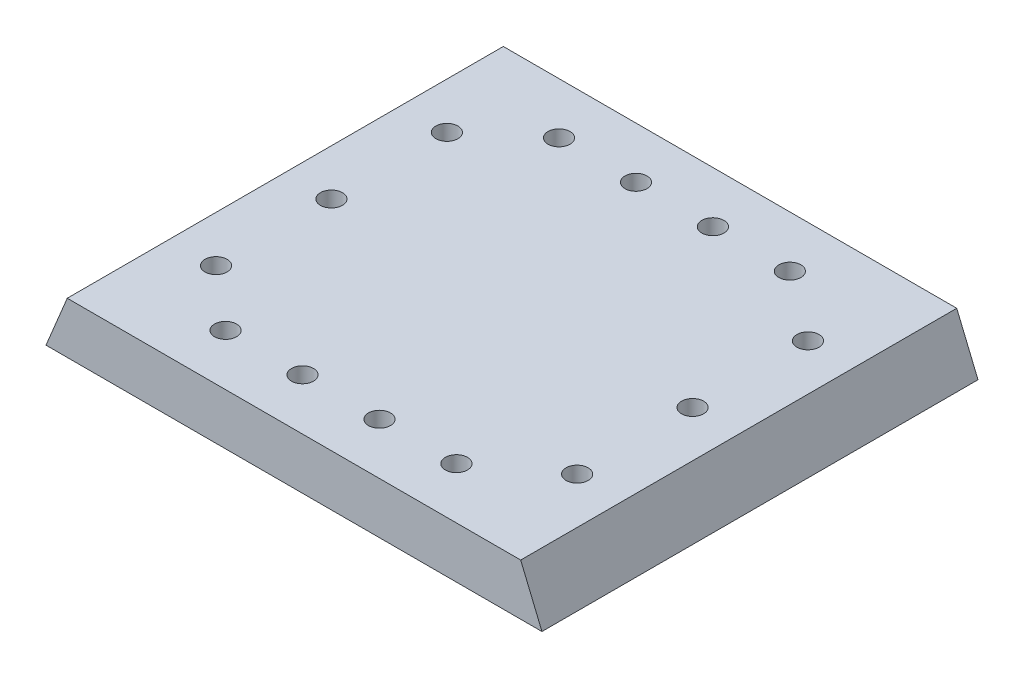
from build123d import *

# Parameters (mm, degrees)
BOSS_EXTRUDE1_DEPTH = 85
SKETCH3_R           = 2.15
CUT_EXTRUDE1_DEPTH  = 85
LPATTERN1_COUNT     = 4
LPATTERN1_PITCH     = 15
SKETCH4_R           = 2.15
CUT_EXTRUDE2_DEPTH  = 85


with BuildPart() as part:
    # Sketch2 → Boss-Extrude1 (new body)
    with BuildSketch(Plane.XY):
        Polygon((0, 0), (96.674271247, 0), (92.532135624, 10), (4.142135624, 10), align=None)
    extrude(amount=BOSS_EXTRUDE1_DEPTH)

    # Sketch3 → Cut-Extrude1 (cut)
    with BuildSketch(Plane.XZ):
        with Locations(Location((25, 75, 0), (0, 0, 270))):
            Circle(SKETCH3_R)
        with Locations((25, 10)):
            Circle(SKETCH3_R)
    cut_extrude1 = extrude(amount=-CUT_EXTRUDE1_DEPTH, mode=Mode.SUBTRACT)

    # LPattern1: Cut-Extrude1 ×4
    with Locations(*[(i * LPATTERN1_PITCH, 0, 0) for i in range(1, LPATTERN1_COUNT)]):
        add(cut_extrude1, mode=Mode.SUBTRACT)

    # Sketch4 → Cut-Extrude2 (cut)
    with BuildSketch(Plane(origin=(0, 10, 0), x_dir=(1, 0, 0), z_dir=(0, 1, 0))):
        with Locations(Location((83.532135624, -20, 0), (0, 0, 180))):
            Circle(SKETCH4_R)
        with Locations(Location((83.532135624, -42.5, 0), (0, 0, 180))):
            Circle(SKETCH4_R)
        with Locations(Location((83.532135624, -65, 0), (0, 0, 180))):
            Circle(SKETCH4_R)
        with Locations(Location((13.142135624, -65, 0), (0, 0, 270))):
            Circle(SKETCH4_R)
        with Locations(Location((13.142135624, -42.5, 0), (0, 0, 270))):
            Circle(SKETCH4_R)
        with Locations(Location((13.142135624, -20, 0), (0, 0, 270))):
            Circle(SKETCH4_R)
    extrude(amount=-CUT_EXTRUDE2_DEPTH, mode=Mode.SUBTRACT)


solid = part.part
